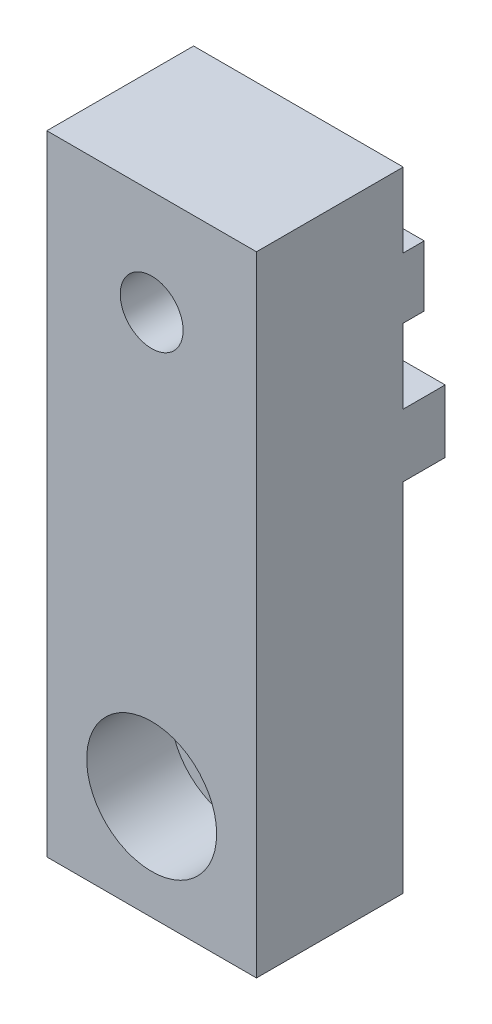
from build123d import *

# Parameters (mm, degrees)
SKETCH1_W           = 10
SKETCH1_H           = 30
MAIN_DEPTH          = 7
SKETCH2_R           = 3.1
SHAFTHOLE_DEPTH     = 4
SKETCH3_W           = 10
SKETCH3_H           = 2.9
BOSS_EXTRUDE1_DEPTH = 1
SKETCH4_R           = 1.5
CUT_EXTRUDE1_DEPTH  = 18.720045147
SKETCH5_W           = 10
SKETCH5_H           = 3
BOSS_EXTRUDE2_DEPTH = 2


with BuildPart() as part:
    # Sketch1 → Main (new body)
    with BuildSketch(Plane.XY):
        Rectangle(SKETCH1_W, SKETCH1_H)
    extrude(amount=MAIN_DEPTH)

    # Sketch2 → ShaftHole (cut)
    with BuildSketch(Plane.XY.offset(7)):
        with Locations((0, -10)):
            Circle(SKETCH2_R)
    extrude(amount=-SHAFTHOLE_DEPTH, mode=Mode.SUBTRACT)

    # Sketch3 → Boss-Extrude1 (add)
    with BuildSketch(Plane(origin=(0, 0, 0), x_dir=(-1, 0, 0), z_dir=(0, 0, -1))):
        with Locations((0, 10)):
            Rectangle(SKETCH3_W, SKETCH3_H)
    extrude(amount=BOSS_EXTRUDE1_DEPTH)

    # Sketch4 → Cut-Extrude1 (cut, through all)
    with BuildSketch(Plane.XY.offset(7)):
        with Locations((0, 10)):
            Circle(SKETCH4_R)
    extrude(amount=-CUT_EXTRUDE1_DEPTH, mode=Mode.SUBTRACT)

    # Sketch5 → Boss-Extrude2 (add)
    with BuildSketch(Plane(origin=(0, 0, 0), x_dir=(-1, 0, 0), z_dir=(0, 0, -1))):
        with Locations((0, 3.5)):
            Rectangle(SKETCH5_W, SKETCH5_H)
    extrude(amount=BOSS_EXTRUDE2_DEPTH)


solid = part.part
